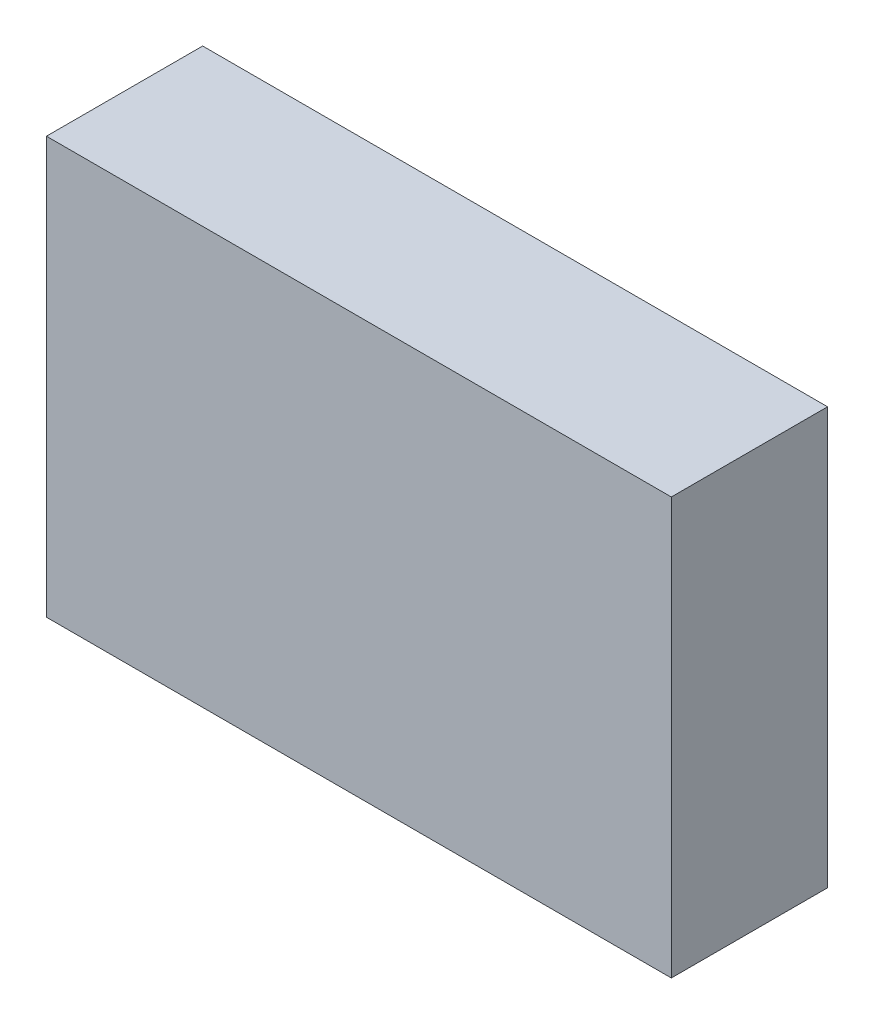
from build123d import *

# Parameters (mm, degrees)
SKETCH1_W           = 60
SKETCH1_H           = 40
BOSS_EXTRUDE1_DEPTH = 15


with BuildPart() as part:
    # Sketch1 → Boss-Extrude1 (new body)
    with BuildSketch(Plane.XY):
        Rectangle(SKETCH1_W, SKETCH1_H)
    extrude(amount=BOSS_EXTRUDE1_DEPTH)


solid = part.part
